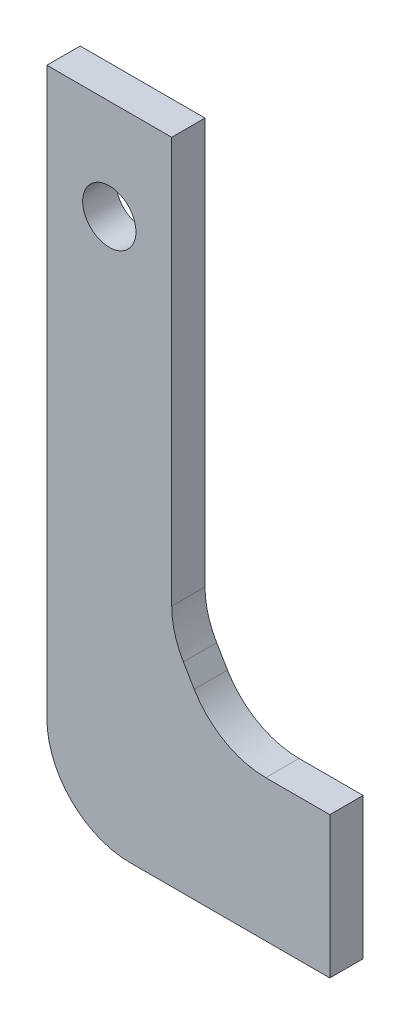
from build123d import *

# Parameters (mm, degrees)
SKETCH_1_R      = 1.6
EXTRUDE_2_DEPTH = 2


with BuildPart() as part:
    # 草图1 → 凸台-拉伸2 (new body)
    with BuildSketch(Plane.XY):
        with BuildLine():
            Line((-13.587712402, 1.954995905), (-14.241535279, 3.056996382))
            ThreePointArc((-14.241535279, 3.056996382), (-14.763277187, 4.285507454), (-14.941422594, 5.608276628))
            Line((-14.941422594, 5.608276628), (-14.941422594, 30.006276151))
            Line((-14.941422594, 30.006276151), (-22.441422594, 30.006276151))
            Line((-22.441422594, 30.006276151), (-22.441422594, -3.993723849))
            ThreePointArc((-22.441422594, -3.993723849), (-20.9769565, -7.529257755), (-17.441422594, -8.993723849))
            Line((-17.441422594, -8.993723849), (-5.441422594, -8.993723849))
            Line((-5.441422594, -8.993723849), (-5.441422594, -0.493723849))
            Line((-5.441422594, -0.493723849), (-9.287599717, -0.493723849))
            ThreePointArc((-9.287599717, -0.493723849), (-11.761826745, 0.161371018), (-13.587712402, 1.954995905))
        make_face()
        with Locations((-18.691422594, 24.006276151)):
            Circle(SKETCH_1_R, mode=Mode.SUBTRACT)
    extrude(amount=EXTRUDE_2_DEPTH)


solid = part.part
